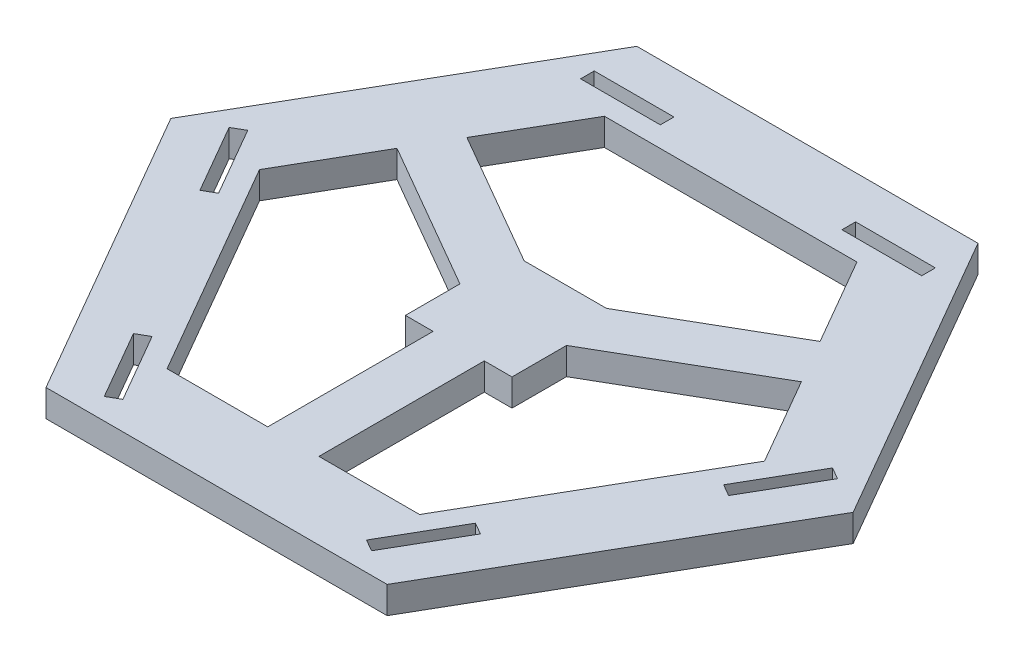
from build123d import *

# Parameters (mm, degrees)
SKETCH1_W           = 18.7
SKETCH1_H           = 3.2
BOSS_EXTRUDE1_DEPTH = 6.35
CUT_EXTRUDE1_DEPTH  = 6.35
BOSS_EXTRUDE2_DEPTH = 6.35
SKETCH4_W           = 25
SKETCH4_H           = 25
BOSS_EXTRUDE3_DEPTH = 6.35


with BuildPart() as part:
    # Sketch1 → Boss-Extrude1 (new body)
    with BuildSketch(Plane(origin=(0, 0, 0), x_dir=(1, 0, 0), z_dir=(0, 1, 0))):
        Polygon((40, -69.282032303), (80, 0), (40, 69.282032303), (-40, 69.282032303), (-80, 0), (-40, -69.282032303), align=None)
        Polygon((-68.56846467, 6.6), (-59.21846467, -9.594675051), (-61.989745962, -11.194675051), (-71.339745962, 5), align=None, mode=Mode.SUBTRACT)
        Polygon((-31.339745962, -64.282032303), (-28.56846467, -62.682032303), (-37.91846467, -46.487357252), (-40.689745962, -48.087357252), align=None, mode=Mode.SUBTRACT)
        Polygon((28.56846467, -62.682032303), (37.91846467, -46.487357252), (40.689745962, -48.087357252), (31.339745962, -64.282032303), align=None, mode=Mode.SUBTRACT)
        Polygon((71.339745962, 5), (68.56846467, 6.6), (59.21846467, -9.594675051), (61.989745962, -11.194675051), align=None, mode=Mode.SUBTRACT)
        with Locations((30.65, 57.682032303)):
            Rectangle(SKETCH1_W, SKETCH1_H, mode=Mode.SUBTRACT)
        with Locations((-30.65, 57.682032303)):
            Rectangle(SKETCH1_W, SKETCH1_H, mode=Mode.SUBTRACT)
    extrude(amount=BOSS_EXTRUDE1_DEPTH)

    # Sketch2 → Cut-Extrude1 (cut)
    with BuildSketch(Plane(origin=(0, 6.35, 0), x_dir=(1, 0, 0), z_dir=(0, 1, 0))):
        Polygon((-59.215390309, 0), (-29.607695155, 51.282032303), (29.607695155, 51.282032303), (59.215390309, 0), (29.607695155, -51.282032303), (-29.607695155, -51.282032303), align=None)
    extrude(amount=-CUT_EXTRUDE1_DEPTH, mode=Mode.SUBTRACT)

    # Sketch3 → Boss-Extrude2 (add)
    with BuildSketch(Plane(origin=(0, 6.35, 0), x_dir=(1, 0, 0), z_dir=(0, 1, 0))):
        Polygon((-6, -3.464101615), (-6, -51.282032303), (6, -51.282032303), (6, -3.464101615), (3, -5.196152423), (0, 0), (-3, -5.196152423), align=None)
        Polygon((6, 0), (6, -3.464101615), (47.411542732, 20.444863729), (41.411542732, 30.837168574), (0, 6.92820323), (3, 5.196152423), (0, 0), align=None)
        Polygon((-47.411542732, 20.444863729), (-6, -3.464101615), (-6, 0), (0, 0), (-3, 5.196152423), (0, 6.92820323), (-41.411542732, 30.837168574), align=None)
        Polygon((-3, 5.196152423), (0, 0), (3, 5.196152423), (0, 6.92820323), align=None)
        Polygon((3, -5.196152423), (6, -3.464101615), (6, 0), (0, 0), align=None)
        Polygon((-6, 0), (-6, -3.464101615), (-3, -5.196152423), (0, 0), align=None)
    extrude(amount=-BOSS_EXTRUDE2_DEPTH)

    # Sketch4 → Boss-Extrude3 (add)
    with BuildSketch(Plane(origin=(0, 6.35, 0), x_dir=(1, 0, 0), z_dir=(0, 1, 0))):
        Rectangle(SKETCH4_W, SKETCH4_H)
    extrude(amount=-BOSS_EXTRUDE3_DEPTH)


solid = part.part
